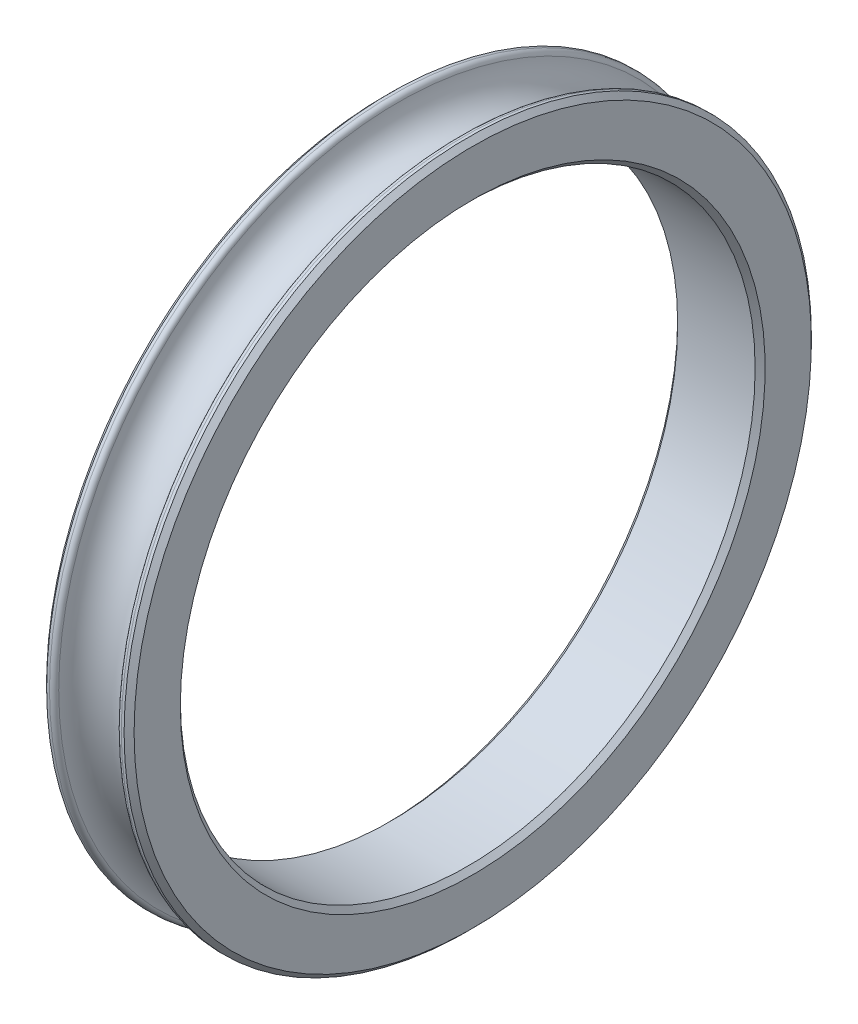
from build123d import *

# Parameters (mm, degrees)
FILLET_1_R     = 0.4
CHAMFER_1_SIZE = 0.4


with BuildPart() as part:
    # 草图1 → 旋转1 (revolve)
    with BuildSketch(Plane.XY, mode=Mode.PRIVATE) as revolve_1_sk:
        with BuildLine():
            Line((3.5, 23), (0, 23))
            Line((0, 23), (-3.5, 23))
            Line((-3.5, 23), (-3.5, 27.5))
            Line((-3.5, 27.5), (-2.5, 27.5))
            ThreePointArc((-2.5, 27.5), (0, 25), (2.5, 27.5))
            Line((2.5, 27.5), (3.5, 27.5))
            Line((3.5, 27.5), (3.5, 23))
        make_face()
    revolve(revolve_1_sk.sketch.rotate(Axis((-16.580648815, 0, 0), (1, 0, 0)), 90), axis=Axis((-16.580648815, 0, 0), (1, 0, 0)))

    # 圆角1
    fillet_1_edges = [part.edges().sort_by_distance(p)[0] for p in [
        (2.5, 0, -27.5),
        (-2.5, 0, -27.5),
    ]]
    fillet(fillet_1_edges, radius=FILLET_1_R)

    # 倒角1
    chamfer_1_edges = [part.edges().sort_by_distance(p)[0] for p in [
        (3.5, 0, -27.5),
        (3.5, 0, -23),
        (-3.5, 0, -23),
        (-3.5, 0, -27.5),
    ]]
    chamfer(chamfer_1_edges, length=CHAMFER_1_SIZE)


solid = part.part
